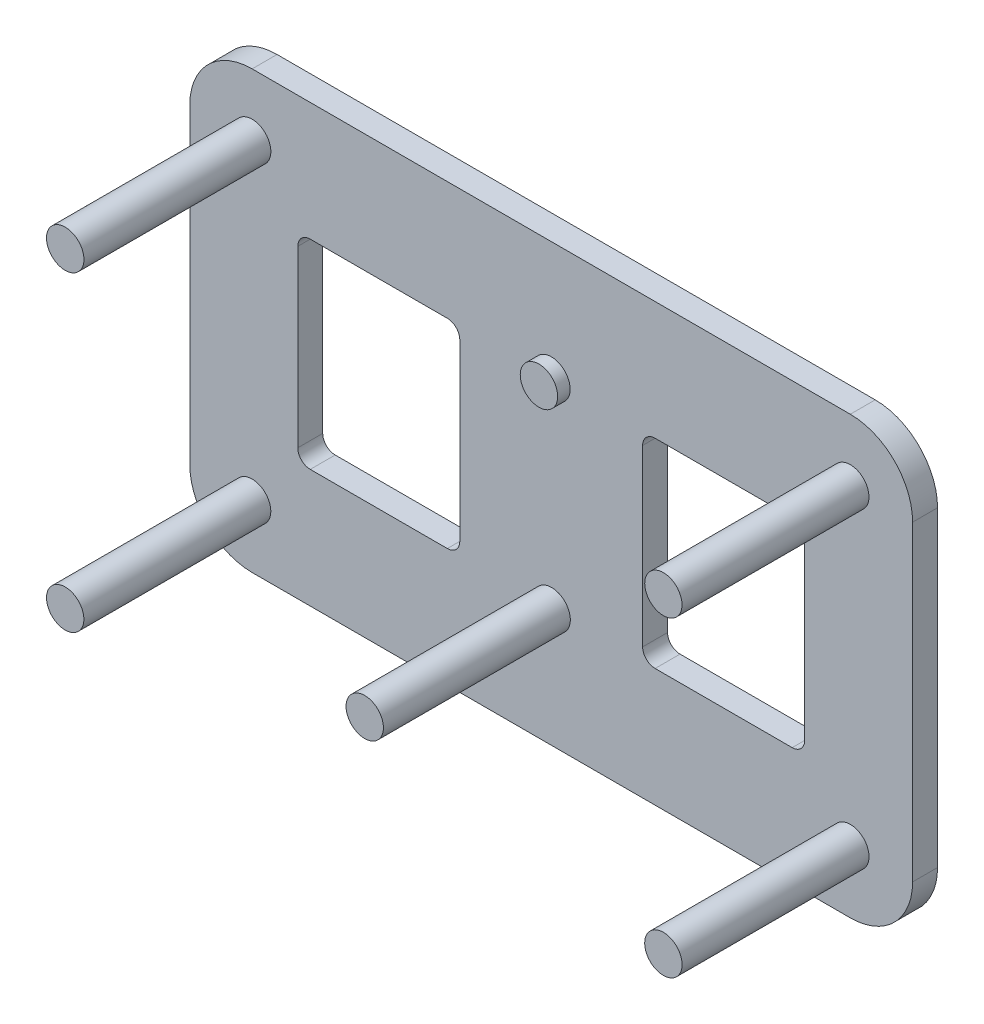
from build123d import *

# Parameters (mm, degrees)
SKIZZE1_W                        = 58
SKIZZE1_H                        = 35
AUFSATZ_LINEAR_AUSTRAGEN1_DEPTH  = 2
VERRUNDUNG1_R                    = 5
SKIZZE10_R                       = 1.496771876
AUFSATZ_LINEAR_AUSTRAGEN6_DEPTH  = 15
SKIZZE11_R                       = 1.503510887
AUFSATZ_LINEAR_AUSTRAGEN7_DEPTH  = 15
SKIZZE12_R                       = 1.498287051
AUFSATZ_LINEAR_AUSTRAGEN8_DEPTH  = 15
SKIZZE13_R                       = 1.500467236
AUFSATZ_LINEAR_AUSTRAGEN9_DEPTH  = 15
SKIZZE23_W                       = 13
SKIZZE23_H                       = 16
SCHNITT_LINEAR_AUSTRAGEN3_DEPTH  = 15
VERRUNDUNG4_R                    = 1
SKIZZE24_R                       = 1.501958256
AUFSATZ_LINEAR_AUSTRAGEN10_DEPTH = 1
SKIZZE26_R                       = 1.499079917
AUFSATZ_LINEAR_AUSTRAGEN11_DEPTH = 15


with BuildPart() as part:
    # Skizze1 → Aufsatz-Linear austragen1 (new body)
    with BuildSketch(Plane.XY):
        with Locations((29, 17.5)):
            Rectangle(SKIZZE1_W, SKIZZE1_H)
    extrude(amount=AUFSATZ_LINEAR_AUSTRAGEN1_DEPTH)

    # Verrundung1
    verrundung1_edges = [part.edges().sort_by_distance(p)[0] for p in [
        (58, 35, 1),
        (0, 0, 1),
        (0, 35, 1),
        (58, 0, 1),
    ]]
    fillet(verrundung1_edges, radius=VERRUNDUNG1_R)

    # Skizze10 → Aufsatz-Linear austragen6 (add)
    with BuildSketch(Plane.XY.offset(2)):
        with Locations((53, 30)):
            Circle(SKIZZE10_R)
    extrude(amount=AUFSATZ_LINEAR_AUSTRAGEN6_DEPTH)

    # Skizze11 → Aufsatz-Linear austragen7 (add)
    with BuildSketch(Plane.XY.offset(2)):
        with Locations((4.999967007, 30)):
            Circle(SKIZZE11_R)
    extrude(amount=AUFSATZ_LINEAR_AUSTRAGEN7_DEPTH)

    # Skizze12 → Aufsatz-Linear austragen8 (add)
    with BuildSketch(Plane.XY.offset(2)):
        with Locations((5, 5)):
            Circle(SKIZZE12_R)
    extrude(amount=AUFSATZ_LINEAR_AUSTRAGEN8_DEPTH)

    # Skizze13 → Aufsatz-Linear austragen9 (add)
    with BuildSketch(Plane.XY.offset(2)):
        with Locations((53, 5)):
            Circle(SKIZZE13_R)
    extrude(amount=AUFSATZ_LINEAR_AUSTRAGEN9_DEPTH)

    # Skizze23 → Schnitt-Linear austragen3 (cut)
    with BuildSketch(Plane.XY.offset(2)):
        with Locations((42.835818152, 17.5)):
            Rectangle(SKIZZE23_W, SKIZZE23_H)
        with Locations((15.164181848, 17.5)):
            Rectangle(SKIZZE23_W, SKIZZE23_H)
    extrude(amount=-SCHNITT_LINEAR_AUSTRAGEN3_DEPTH, mode=Mode.SUBTRACT)

    # Verrundung4
    verrundung4_edges = [part.edges().sort_by_distance(p)[0] for p in [
        (49.335818152, 9.5, 1),
        (21.664181848, 9.5, 1),
        (36.335818152, 9.5, 1),
        (8.664181848, 9.5, 1),
        (36.335818152, 25.5, 1),
        (49.335818152, 25.5, 1),
        (21.664181848, 25.5, 1),
        (8.664181848, 25.5, 1),
    ]]
    fillet(verrundung4_edges, radius=VERRUNDUNG4_R)

    # Skizze24 → Aufsatz-Linear austragen10 (add)
    with BuildSketch(Plane.XY.offset(2)):
        with Locations((29.015481973, 25.496020028)):
            Circle(SKIZZE24_R)
    extrude(amount=AUFSATZ_LINEAR_AUSTRAGEN10_DEPTH)

    # Skizze26 → Aufsatz-Linear austragen11 (add)
    with BuildSketch(Plane.XY.offset(2)):
        with Locations((29.034976799, 9.476495672)):
            Circle(SKIZZE26_R)
    extrude(amount=AUFSATZ_LINEAR_AUSTRAGEN11_DEPTH)


solid = part.part
